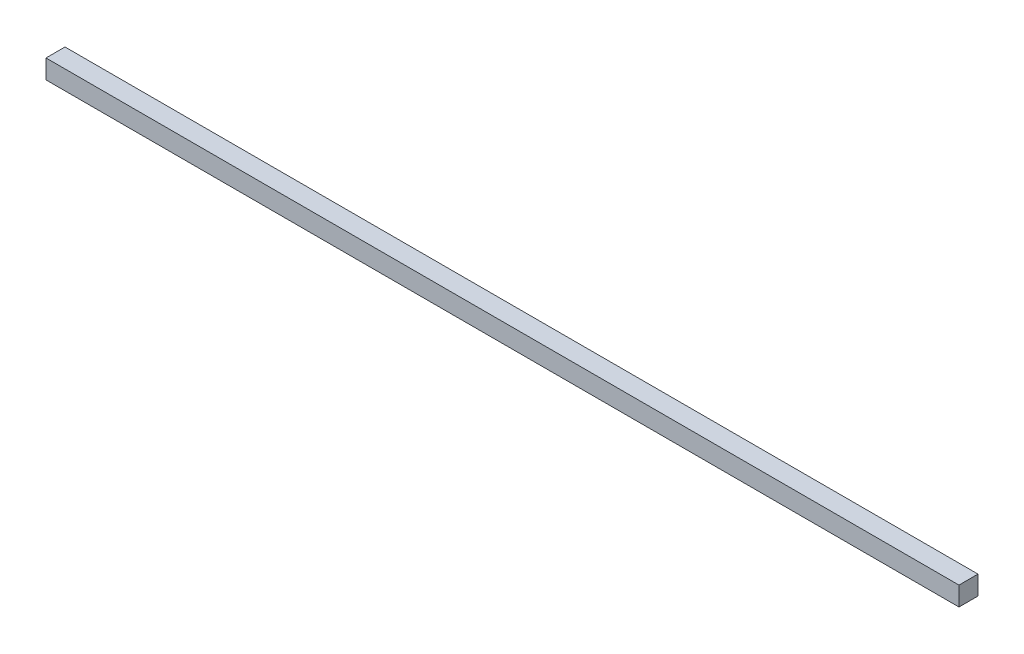
from build123d import *

# Parameters (mm, degrees)
SKETCH1_W           = 6.35
SKETCH1_H           = 6.35
BOSS_EXTRUDE1_DEPTH = 152.4


with BuildPart() as part:
    # Sketch1 → Boss-Extrude1 (new, symmetric)
    with BuildSketch(Plane(origin=(0, 0, 0), x_dir=(0, 0, -1), z_dir=(1, 0, 0))):
        Rectangle(SKETCH1_W, SKETCH1_H)
    extrude(amount=BOSS_EXTRUDE1_DEPTH, both=True)


solid = part.part
